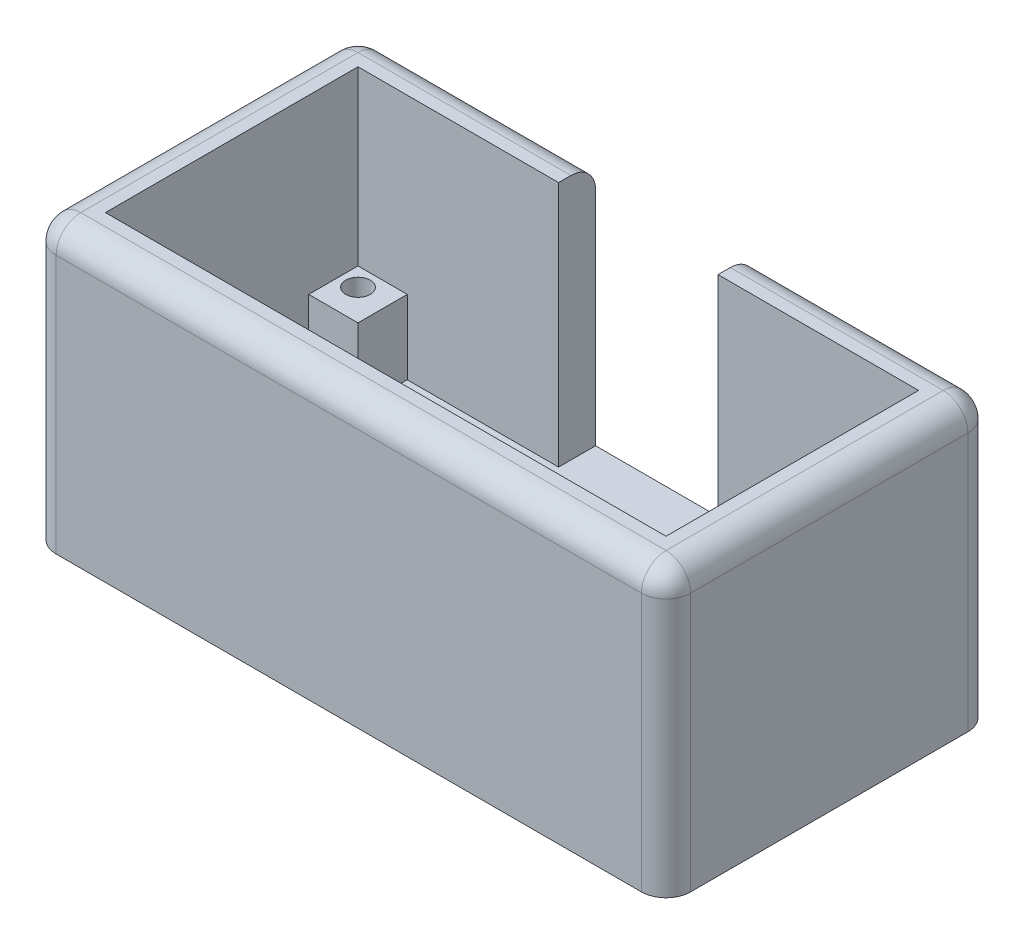
from build123d import *

# Parameters (mm, degrees)
EXTRUDE_1_DEPTH = 20
SKETCH_1_3_W    = 4
SKETCH_1_3_H    = 4
SKETCH_1_3_R    = 1
EXTRUDE_2_DEPTH = 6
SKETCH_1_4_W    = 51.5
SKETCH_1_4_H    = 26.5
EXTRUDE_3_DEPTH = 3
FILLET_1_R      = 2


with BuildPart() as part:
    # Эскиз1 → Бобышка-Вытянуть1 (new body)
    with BuildSketch(Plane(origin=(0, 0, 0), x_dir=(1, 0, 0), z_dir=(0, 1, 0))):
        Polygon((-23, 6.5), (-23, 10.5), (-19, 10.5), (-6.718518259, 10.5), (-6.718518259, 13.5), (-26, 13.5), (-26, -13), (25.5, -13), (25.5, 13.5), (6.218518259, 13.5), (6.218518259, 10.5), (18.5, 10.5), (22.5, 10.5), (22.5, 6.5), (22.5, -6), (22.5, -10), (18.5, -10), (-19, -10), (-23, -10), (-23, -6), align=None)
    extrude(amount=EXTRUDE_1_DEPTH)

    # Эскиз1<3> → Бобышка-Вытянуть2 (add)
    # profile 1 of 4: a face of its own
    with BuildSketch(Plane(origin=(0, 0, 0), x_dir=(1, 0, 0), z_dir=(0, 1, 0))):
        with Locations((-21, 8.5)):
            Rectangle(SKETCH_1_3_W, SKETCH_1_3_H)
        with Locations((-21.5, 9)):
            Circle(SKETCH_1_3_R, mode=Mode.SUBTRACT)
    # profile 2 of 4: a face of its own
    with BuildSketch(Plane(origin=(0, 0, 0), x_dir=(1, 0, 0), z_dir=(0, 1, 0))):
        with Locations((-21, -8)):
            Rectangle(SKETCH_1_3_W, SKETCH_1_3_H)
        with Locations((-21.5, -8.5)):
            Circle(SKETCH_1_3_R, mode=Mode.SUBTRACT)
    # profile 3 of 4: a face of its own
    with BuildSketch(Plane(origin=(0, 0, 0), x_dir=(1, 0, 0), z_dir=(0, 1, 0))):
        with Locations((20.5, 8.5)):
            Rectangle(SKETCH_1_3_W, SKETCH_1_3_H)
        with Locations((21, 9)):
            Circle(SKETCH_1_3_R, mode=Mode.SUBTRACT)
    # profile 4 of 4: a face of its own
    with BuildSketch(Plane(origin=(0, 0, 0), x_dir=(1, 0, 0), z_dir=(0, 1, 0))):
        with Locations((20.5, -8)):
            Rectangle(SKETCH_1_3_W, SKETCH_1_3_H)
        with Locations((21, -8.5)):
            Circle(SKETCH_1_3_R, mode=Mode.SUBTRACT)
    extrude(amount=EXTRUDE_2_DEPTH)

    # Эскиз1<4> → Бобышка-Вытянуть3 (add)
    with BuildSketch(Plane(origin=(0, 0, 0), x_dir=(1, 0, 0), z_dir=(0, 1, 0))):
        with Locations((-0.25, 0.25)):
            Rectangle(SKETCH_1_4_W, SKETCH_1_4_H)
    extrude(amount=-EXTRUDE_3_DEPTH)

    # Скругление1
    fillet_1_edges = [part.edges().sort_by_distance(p)[0] for p in [
        (-26, 20, -0.25),
        (-16.359259129, 20, -13.5),
        (15.859259129, 20, -13.5),
        (25.5, 20, -0.25),
        (-0.25, 20, 13),
        (-26, 8.5, 13),
        (-26, 8.5, -13.5),
        (25.5, 8.5, -13.5),
        (25.5, 8.5, 13),
    ]]
    fillet(fillet_1_edges, radius=FILLET_1_R)


solid = part.part
